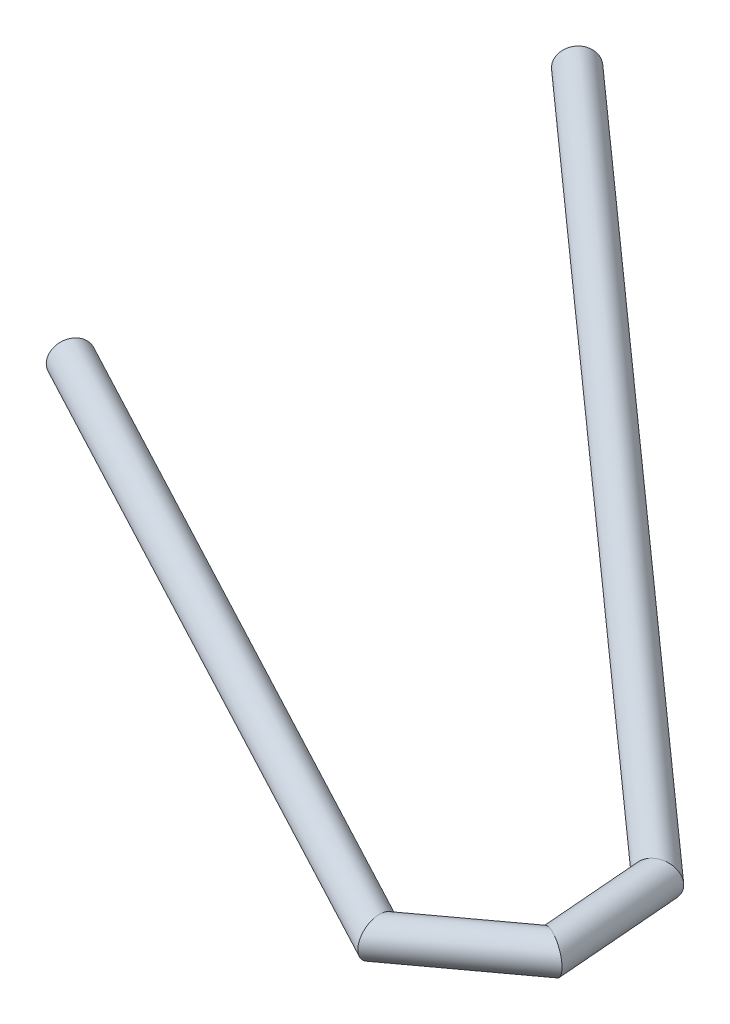
from build123d import *

# Parameters (mm, degrees)
SKETCH3_R = 6.352003692


with BuildPart() as part:
    # Sweep1: sweep along a path in Sketch1
    with BuildLine(Plane(origin=(0, 39.1414, 0), x_dir=(-1, 0, 0), z_dir=(0, 1, 0))) as sweep1_path:
        Line((141.959662456, 22.704306733), (-86.020814471, 143.574848389))
        Line((-86.020814471, 143.574848389), (-120.999430259, 117.827610247))
        Line((-120.999430259, 117.827610247), (-117.755022381, 77.657593152))
        Line((-117.755022381, 77.657593152), (141.959662456, -154.014648133))
    # Sketch3 → Sweep1 (sweep)
    with BuildSketch(Plane(origin=(-141.959662456, 39.1414, -154.014648133), x_dir=(-0.6656705677354647, 1.727731506709886e-15, 0.74624573382415), z_dir=(-0.74624573382415, 1.933959328178795e-15, -0.6656705677354647))):
        Circle(SKETCH3_R)
    sweep(path=sweep1_path.line, transition=Transition.RIGHT)


solid = part.part
